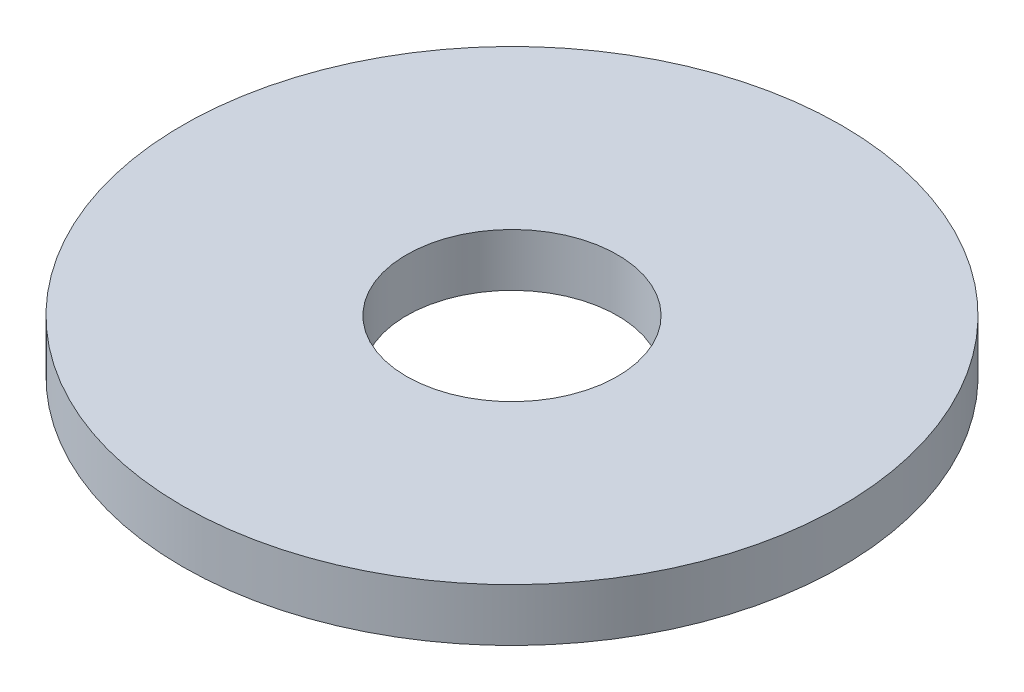
from build123d import *

# Parameters (mm, degrees)
SKETCH1_R           = 5
SKETCH1_R_2         = 1.6
BOSS_EXTRUDE1_DEPTH = 0.4


with BuildPart() as part:
    # Sketch1 → Boss-Extrude1 (new, symmetric)
    with BuildSketch(Plane(origin=(0, 0, 0), x_dir=(1, 0, 0), z_dir=(0, 1, 0))):
        with Locations(Location((0, 0, 0), (0, 0, 270))):
            Circle(SKETCH1_R)
        with Locations(Location((0, 0, 0), (0, 0, 270))):
            Circle(SKETCH1_R_2, mode=Mode.SUBTRACT)
    extrude(amount=BOSS_EXTRUDE1_DEPTH, both=True)


solid = part.part
